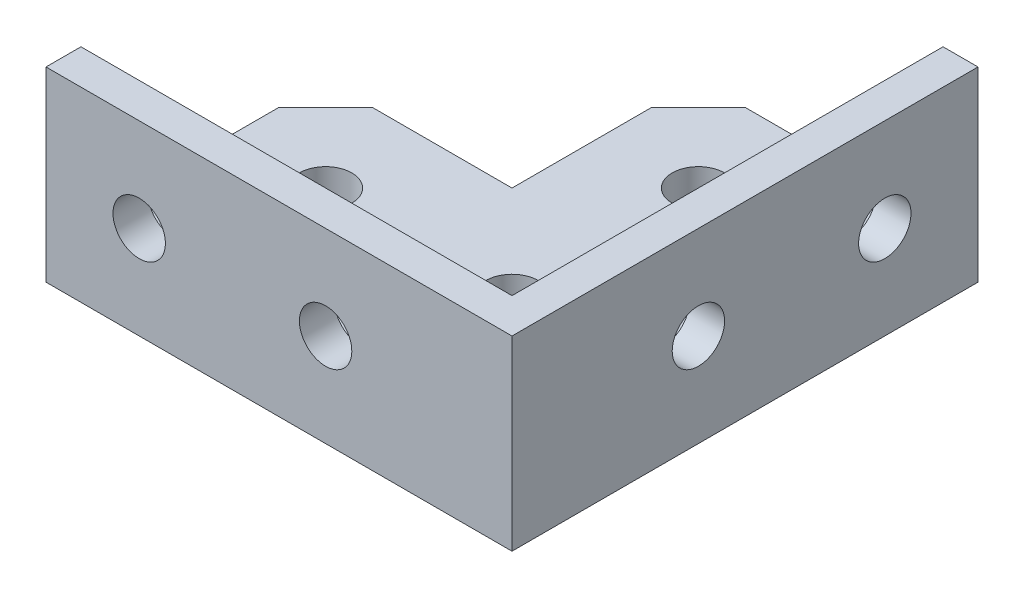
from build123d import *

# Parameters (mm, degrees)
BOSS_EXTRUDE1_DEPTH     = 63.5
F_1_4_CLEARANCE_HOLE1_D = 7.14248
F_1_4_CLEARANCE_HOLE2_D = 7.14248
CHAMFER4_SIZE           = 6.35


with BuildPart() as part:
    # Sketch1 → Boss-Extrude1 (new body)
    with BuildSketch(Plane.XY):
        Polygon((0, 0), (38.1, 0), (38.1, 25.4), (33.3375, 25.4), (33.3375, 4.7625), (0, 4.7625), align=None)
    boss_extrude1 = extrude(amount=BOSS_EXTRUDE1_DEPTH)

    # 1/4 Clearance Hole1 (through all)
    with Locations(Plane(origin=(0, 4.7625, 0), x_dir=(1, 0, 0), z_dir=(0, 1, 0))):
        with Locations((12.7, -12.7), (12.7, -38.1)):
            f_1_4_clearance_hole1 = Hole(F_1_4_CLEARANCE_HOLE1_D / 2)

    # 1/4 Clearance Hole2 (through all)
    with Locations(Plane.ZY.offset(-33.3375)):
        with Locations((38.1, 12.7), (12.7, 12.7)):
            f_1_4_clearance_hole2 = Hole(F_1_4_CLEARANCE_HOLE2_D / 2)

    # Mirror1: Boss-Extrude1, 1/4 Clearance Hole1, 1/4 Clearance Hole2 across plane
    add(boss_extrude1.mirror(Plane(origin=(-12.7, 0, 12.7), x_dir=(0.7071067811865477, 0, 0.7071067811865474), z_dir=(0.7071067811865474, 0, -0.7071067811865477))))
    add(f_1_4_clearance_hole1.mirror(Plane(origin=(-12.7, 0, 12.7), x_dir=(0.7071067811865477, 0, 0.7071067811865474), z_dir=(0.7071067811865474, 0, -0.7071067811865477))), mode=Mode.SUBTRACT)
    add(f_1_4_clearance_hole2.mirror(Plane(origin=(-12.7, 0, 12.7), x_dir=(0.7071067811865477, 0, 0.7071067811865474), z_dir=(0.7071067811865474, 0, -0.7071067811865477))), mode=Mode.SUBTRACT)

    # Chamfer4
    chamfer4_edges = [part.edges().sort_by_distance(p)[0] for p in [
        (-25.4, 2.38125, 25.4),
        (0, 2.38125, 0),
    ]]
    chamfer(chamfer4_edges, length=CHAMFER4_SIZE)


solid = part.part
